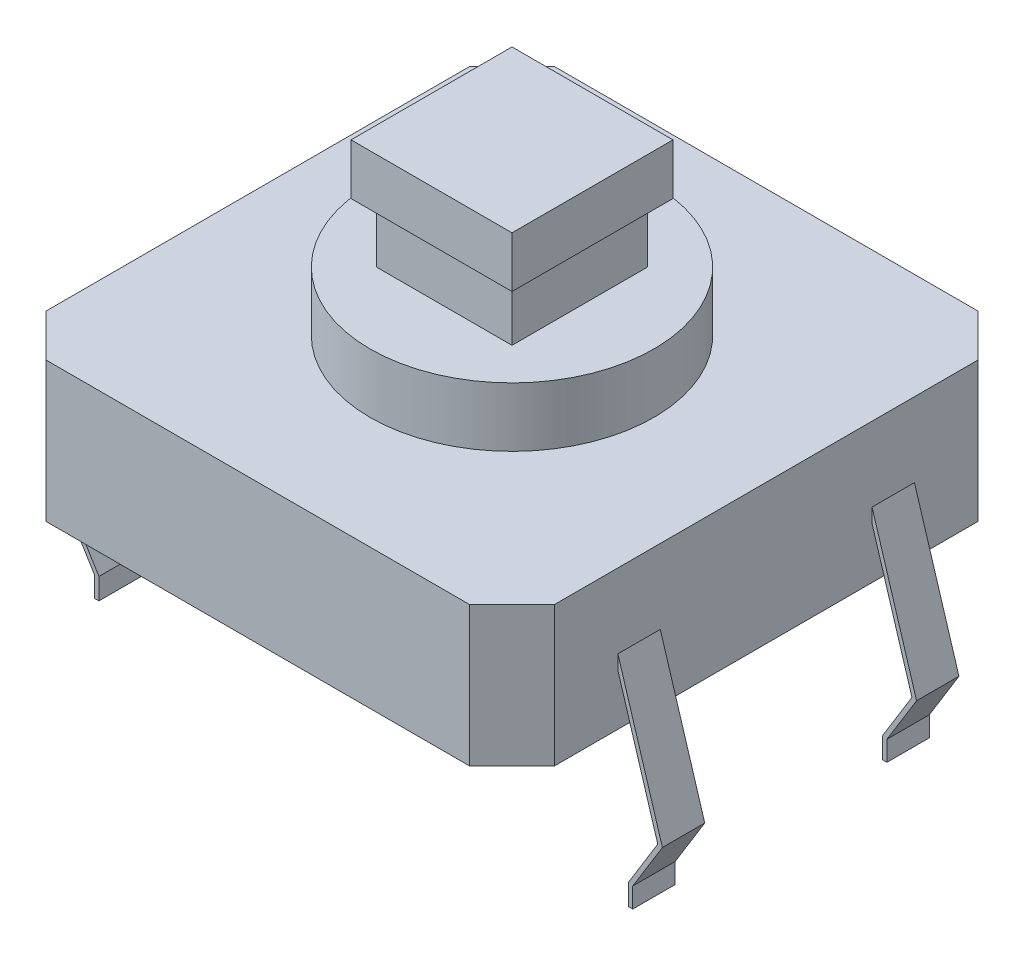
from build123d import *

# Parameters (mm, degrees)
BOSS_EXTRUDE1_DEPTH = 3.3
BOSS_EXTRUDE2_START = 3.3
SKETCH3_R           = 3.35
BOSS_EXTRUDE2_DEPTH = 1.4
BOSS_EXTRUDE3_START = 4.7
SKETCH3_3_W         = 3.2
SKETCH3_3_H         = 3.2
BOSS_EXTRUDE3_DEPTH = 1.4
BOSS_EXTRUDE4_START = 6.1
SKETCH3_4_W         = 3.8
SKETCH3_4_H         = 3.8
BOSS_EXTRUDE4_DEPTH = 1.2
BOSS_EXTRUDE5_START = 2.5
BOSS_EXTRUDE5_DEPTH = 1
BOSS_EXTRUDE6_START = -2.5
BOSS_EXTRUDE6_DEPTH = 1


with BuildPart() as part:
    # Sketch1 → Boss-Extrude1 (new body)
    with BuildSketch(Plane(origin=(0, 0, 0), x_dir=(1, 0, 0), z_dir=(0, 1, 0))):
        Polygon((-5, 6), (-6, 5), (-6, -5), (-5, -6), (5, -6), (6, -5), (6, 5), (5, 6), align=None)
    extrude(amount=BOSS_EXTRUDE1_DEPTH)

    # Sketch3 → Boss-Extrude2 (add)
    with BuildSketch(Plane(origin=(0, 0, 0), x_dir=(1, 0, 0), z_dir=(0, 1, 0)).offset(BOSS_EXTRUDE2_START)):
        with Locations(Location((0, 0, 0), (0, 0, 270))):
            Circle(SKETCH3_R)
    extrude(amount=BOSS_EXTRUDE2_DEPTH)

    # Sketch3<3> → Boss-Extrude3 (add)
    with BuildSketch(Plane(origin=(0, 0, 0), x_dir=(1, 0, 0), z_dir=(0, 1, 0)).offset(BOSS_EXTRUDE3_START)):
        Rectangle(SKETCH3_3_W, SKETCH3_3_H)
    extrude(amount=BOSS_EXTRUDE3_DEPTH)

    # Sketch3<4> → Boss-Extrude4 (add)
    with BuildSketch(Plane(origin=(0, 0, 0), x_dir=(1, 0, 0), z_dir=(0, 1, 0)).offset(BOSS_EXTRUDE4_START)):
        Rectangle(SKETCH3_4_W, SKETCH3_4_H)
    extrude(amount=BOSS_EXTRUDE4_DEPTH)

    # Sketch4 → Boss-Extrude5 (add)
    with BuildSketch(Plane.XY.offset(BOSS_EXTRUDE5_START)):
        Polygon((6, 1.543469882), (7.05, -1.890925367), (6.35, -3.028306733), (6.35, -3.5), (6.25, -3.5), (6.25, -3), (6.941165312, -1.876973505), (6, 1.20143952), align=None)
        Polygon((-6.941165312, -1.876973505), (-6, 1.20143952), (-6, 1.543469882), (-7.05, -1.890925367), (-6.35, -3.028306733), (-6.35, -3.5), (-6.25, -3.5), (-6.25, -3), align=None)
    extrude(amount=BOSS_EXTRUDE5_DEPTH)

    # Sketch4<2> → Boss-Extrude6 (add)
    with BuildSketch(Plane.XY.offset(BOSS_EXTRUDE6_START)):
        Polygon((6, 1.543469882), (7.05, -1.890925367), (6.35, -3.028306733), (6.35, -3.5), (6.25, -3.5), (6.25, -3), (6.941165312, -1.876973505), (6, 1.20143952), align=None)
        Polygon((-6.941165312, -1.876973505), (-6, 1.20143952), (-6, 1.543469882), (-7.05, -1.890925367), (-6.35, -3.028306733), (-6.35, -3.5), (-6.25, -3.5), (-6.25, -3), align=None)
    extrude(amount=-BOSS_EXTRUDE6_DEPTH)


solid = part.part
